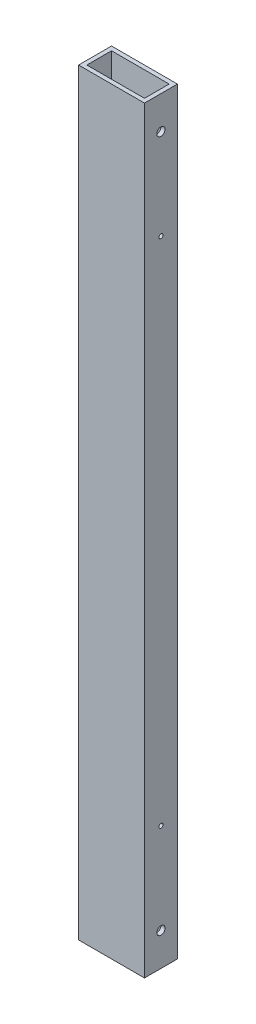
from build123d import *

# Parameters (mm, degrees)
SKETCH1_W           = 50.8
SKETCH1_H           = 25.4
SKETCH1_W_2         = 44.45
SKETCH1_H_2         = 19.05
BOSS_EXTRUDE1_DEPTH = 584.2
SKETCH2_R           = 1.5875
CUT_EXTRUDE1_DEPTH  = 587.825553828
SKETCH3_R           = 3.175
CUT_EXTRUDE2_DEPTH  = 587.825553828


with BuildPart() as part:
    # Sketch1 → Boss-Extrude1 (new body)
    with BuildSketch(Plane(origin=(0, 0, 0), x_dir=(1, 0, 0), z_dir=(0, 1, 0))):
        with Locations((22.225, 9.525)):
            Rectangle(SKETCH1_W, SKETCH1_H)
        with Locations((22.225, 9.525)):
            Rectangle(SKETCH1_W_2, SKETCH1_H_2, mode=Mode.SUBTRACT)
    extrude(amount=BOSS_EXTRUDE1_DEPTH)

    # Sketch2 → Cut-Extrude1 (cut, through all)
    with BuildSketch(Plane(origin=(47.625, 0, 0), x_dir=(0, 0, -1), z_dir=(1, 0, 0))):
        with Locations((9.525, 95.25)):
            Circle(SKETCH2_R)
        with Locations((9.525, 488.95)):
            Circle(SKETCH2_R)
    extrude(amount=-CUT_EXTRUDE1_DEPTH, mode=Mode.SUBTRACT)

    # Sketch3 → Cut-Extrude2 (cut, through all)
    with BuildSketch(Plane.ZY.offset(3.175)):
        with Locations((-9.525, 25.4)):
            Circle(SKETCH3_R)
        with Locations((-9.525, 558.8)):
            Circle(SKETCH3_R)
    extrude(amount=-CUT_EXTRUDE2_DEPTH, mode=Mode.SUBTRACT)


solid = part.part
